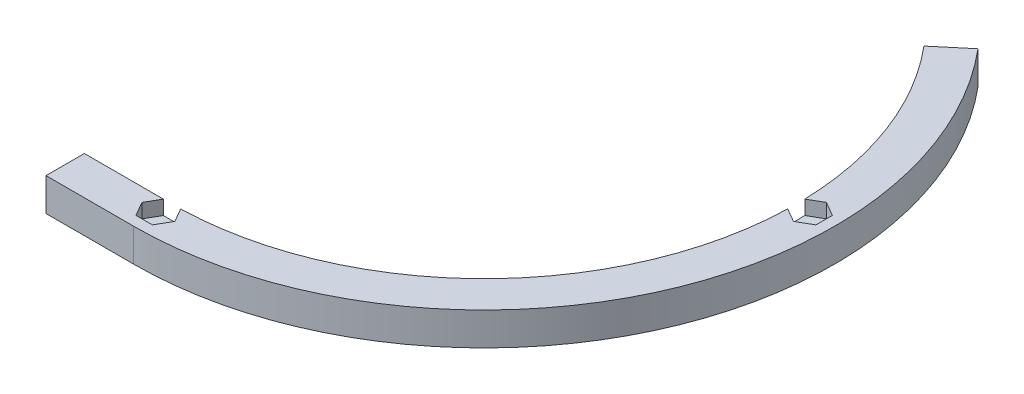
from build123d import *

# Parameters (mm, degrees)
BOSS_EXTRUDE1_DEPTH = 15
SKETCH2_W           = 17.5
SKETCH2_H           = 15
BOSS_EXTRUDE2_DEPTH = 40
CUT_EXTRUDE1_DEPTH  = 6.5


with BuildPart() as part:
    # Sketch1 → Boss-Extrude1 (new body)
    with BuildSketch(Plane(origin=(0, 0, 0), x_dir=(1, 0, 0), z_dir=(0, 1, 0))):
        with BuildLine():
            ThreePointArc((142.5, 0), (100.762716319, -100.762716319), (0, -142.5))
            Line((0, -142.5), (0, -160))
            ThreePointArc((0, -160), (113.13708499, -113.13708499), (160, 0))
            ThreePointArc((160, 0), (150.350819326, 54.723222932), (122.567110899, 102.84601755))
            Line((122.567110899, 102.84601755), (109.161333144, 91.59723438))
            ThreePointArc((109.161333144, 91.59723438), (133.906198462, 48.737870424), (142.5, 0))
        make_face()
    extrude(amount=BOSS_EXTRUDE1_DEPTH)

    # Sketch2 → Boss-Extrude2 (add)
    with BuildSketch(Plane.ZY):
        with Locations((151.25, 7.5)):
            Rectangle(SKETCH2_W, SKETCH2_H)
    extrude(amount=BOSS_EXTRUDE2_DEPTH)

    # Sketch3 → Cut-Extrude1 (cut)
    with BuildSketch(Plane(origin=(0, 15, 0), x_dir=(1, 0, 0), z_dir=(0, 1, 0))):
        Polygon((-3.75277675, -142.2), (-7.505553499, -148.7), (-3.75277675, -155.2), (3.75277675, -155.2), (7.505553499, -148.7), (3.75277675, -142.2), align=None)
        Polygon((142.2, 3.75277675), (142.2, -3.75277675), (148.7, -7.505553499), (155.2, -3.75277675), (155.2, 3.75277675), (148.7, 7.505553499), align=None)
    extrude(amount=-CUT_EXTRUDE1_DEPTH, mode=Mode.SUBTRACT)


solid = part.part
